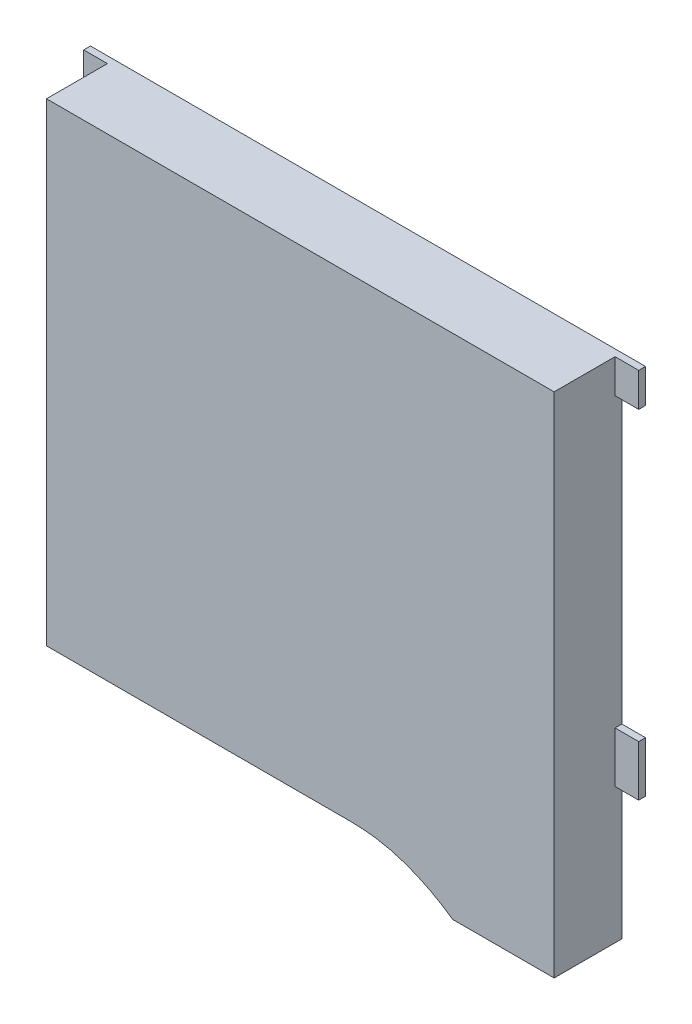
from build123d import *

# Parameters (mm, degrees)
BOSS_EXTRUDE1_DEPTH = 2
SKETCH2_W           = 11
SKETCH2_H           = 1.1
CUT_EXTRUDE1_DEPTH  = 12
SKETCH3_W           = 0.7
SKETCH3_H           = 1
SKETCH3_H_2         = 1.5
BOSS_EXTRUDE2_DEPTH = 0.2


with BuildPart() as part:
    # Sketch1 → Boss-Extrude1 (new body)
    with BuildSketch(Plane.XY):
        with BuildLine():
            Line((-7.5, 7.5), (7.5, 7.5))
            Line((7.5, 7.5), (7.5, -7.5))
            Line((7.5, -7.5), (4.5, -7.5))
            add(Edge.make_bspline(
                [(1.5, -6.5), (3.08113883, -6.5), (4.5, -7.5)],
                knots=[0, 0, 0, 1, 1, 1], degree=2))
            Line((1.5, -6.5), (-7.5, -6.5))
            Line((-7.5, -6.5), (-7.5, 7.5))
        make_face()
    extrude(amount=BOSS_EXTRUDE1_DEPTH)

    # Sketch2 → Cut-Extrude1 (cut)
    with BuildSketch(Plane.XZ.offset(7.5)):
        with Locations((-1, 1.25)):
            Rectangle(SKETCH2_W, SKETCH2_H)
    extrude(amount=-CUT_EXTRUDE1_DEPTH, mode=Mode.SUBTRACT)

    # Sketch3 → Boss-Extrude2 (add)
    with BuildSketch(Plane.XY):
        with Locations((7.85, 7)):
            Rectangle(SKETCH3_W, SKETCH3_H)
        with Locations((-7.85, 7)):
            Rectangle(SKETCH3_W, SKETCH3_H)
        with Locations((-7.85, -2.75)):
            Rectangle(SKETCH3_W, SKETCH3_H_2)
        with Locations((7.85, -2.75)):
            Rectangle(SKETCH3_W, SKETCH3_H_2)
    extrude(amount=BOSS_EXTRUDE2_DEPTH)


solid = part.part
